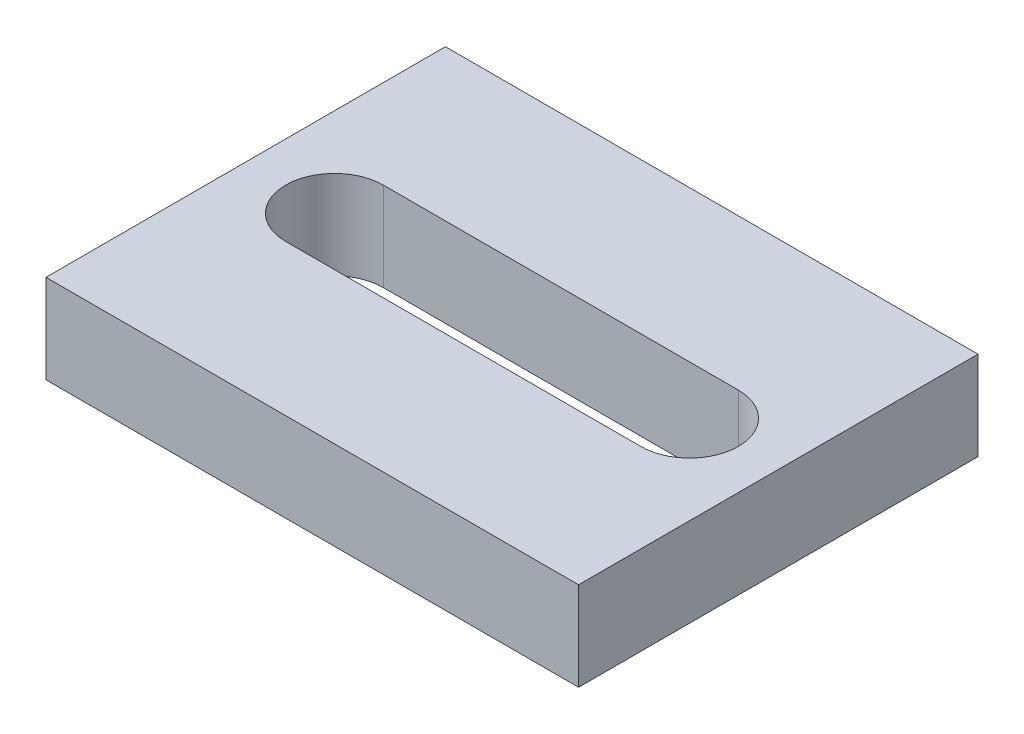
from build123d import *

# Parameters (mm, degrees)
SKETCH1_W           = 76.2
SKETCH1_H           = 57.15
BOSS_EXTRUDE1_DEPTH = 6.35


with BuildPart() as part:
    # Sketch1 → Boss-Extrude1 (new, symmetric)
    with BuildSketch(Plane(origin=(0, 0, 0), x_dir=(1, 0, 0), z_dir=(0, 1, 0))):
        Rectangle(SKETCH1_W, SKETCH1_H)
        with BuildLine():
            Line((-25.4, 6.985), (25.4, 6.985))
            ThreePointArc((25.4, 6.985), (32.385, 0), (25.4, -6.985))
            Line((25.4, -6.985), (-25.4, -6.985))
            ThreePointArc((-25.4, -6.985), (-32.385, 0), (-25.4, 6.985))
        make_face(mode=Mode.SUBTRACT)
    extrude(amount=BOSS_EXTRUDE1_DEPTH, both=True)


solid = part.part
